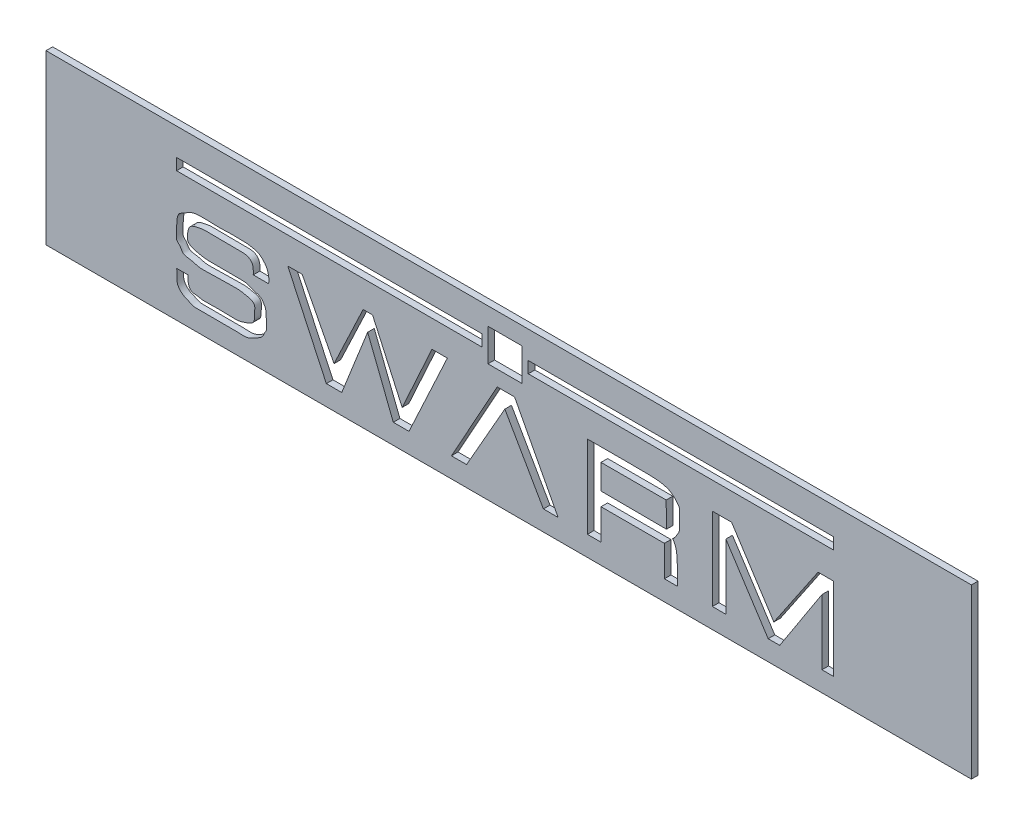
from build123d import *

# Parameters (mm, degrees)
SKETCH1_W           = 444.5
SKETCH1_H           = 80.8
BOSS_EXTRUDE4_DEPTH = 3.175
SKETCH2_W           = 16.441805151
SKETCH2_H           = 15.633348054
SKETCH2_W_2         = 146.679742779
SKETCH2_H_2         = 5.535084634
SKETCH2_W_3         = 146.570115186
CUT_EXTRUDE1_DEPTH  = 16.51


with BuildPart() as part:
    # Sketch1 → Boss-Extrude4 (new body)
    with BuildSketch(Plane.XY):
        Rectangle(SKETCH1_W, SKETCH1_H)
    extrude(amount=-BOSS_EXTRUDE4_DEPTH)

    # Sketch2 → Cut-Extrude1 (cut)
    # profile 1 of 8: a face of its own
    with BuildSketch(Plane.XY):
        Polygon((148.602737407, 8.884542425), (155.961815318, 8.884542425), (155.961815318, -30.781321228), (150.468409481, -30.781321228), (150.468409481, 0.510550481), (130.175928228, -30.781321228), (124.636339422, -30.781321228), (104.301025409, 0.510550481), (104.301025409, -30.781321228), (97.84342667, -30.781321228), (97.84342667, 8.88678531), (107.068567725, 8.88678531), (127.350736795, -22.475093169), align=None)
    # profile 2 of 8: a face of its own
    with BuildSketch(Plane.XY):
        with BuildLine():
            Line((-122.706183837, -3.100392438), (-115.29908876, -3.100392438))
            add(Edge.make_bspline(
                [(-153.955923735, -18.776758223), (-154.285309436, -20.049679681), (-153.998746065, -25.337589484), (-149.679525775, -25.044252719), (-147.12149358, -25.938004263), (-144.206243228, -25.584153299), (-141.137657535, -25.732833066), (-137.67620499, -25.556266991), (-133.579228954, -25.761730355), (-129.745809737, -25.971105624), (-126.603680721, -24.885158192), (-124.452192594, -24.20190402), (-122.333482976, -22.872921562), (-121.993734868, -20.217578477), (-122.074943283, -17.834237964), (-121.832356095, -15.592649885), (-123.350183225, -13.815503909), (-125.913514769, -13.448674393), (-129.84536896, -12.443046304), (-133.982629024, -12.881901543), (-138.256850641, -12.811721774), (-141.637329939, -12.806908226), (-145.040083518, -12.884098216), (-148.83983037, -13.194232926), (-152.353461672, -11.655107864), (-156.686254483, -11.671684433), (-157.610093899, -8.579886425), (-159.707975852, -7.276961097), (-159.507396209, -4.571392822), (-159.635611158, -2.071741332), (-159.338561795, 0.56264845), (-159.249198149, 2.823335191), (-158.445334643, 4.68686483), (-157.174717873, 5.310025192), (-155.62784179, 6.0415247), (-153.481788062, 7.7805497), (-149.806843205, 8.700840026), (-146.185738392, 8.682663541), (-142.925843245, 8.504844854), (-139.440314938, 8.421166009), (-135.909624754, 8.371534854), (-132.135649038, 8.711452422), (-128.754360131, 8.583571975), (-125.049674762, 8.483876189), (-121.973185918, 7.885366456), (-119.550938225, 6.928900557), (-118.392490992, 5.813751928), (-115.720511104, 3.220589753), (-114.860670335, -0.353122863), (-115.29908876, -3.100392438)],
                knots=[0, 0, 0, 0, 0.04400038, 0.060874094, 0.07938466, 0.099252042, 0.11924267, 0.142092473, 0.169517765, 0.203050698, 0.218676173, 0.236483832, 0.249692023, 0.266333318, 0.286427524, 0.300449309, 0.30919807, 0.330906295, 0.350445275, 0.392282993, 0.413701241, 0.437671923, 0.460875468, 0.483403744, 0.513308057, 0.540182664, 0.558429201, 0.571897175, 0.586029079, 0.608413871, 0.624676927, 0.639265682, 0.655062081, 0.662121602, 0.66746828, 0.689978255, 0.717350654, 0.742328991, 0.763637513, 0.783748967, 0.813268626, 0.835402192, 0.860710681, 0.882040584, 0.910691104, 0.924247372, 0.934075314, 0.943084244, 1, 1, 1, 1], degree=3))
            Line((-153.955923735, -18.776758223), (-159.538008772, -18.776758223))
            add(Edge.make_bspline(
                [(-159.538008772, -18.776758223), (-158.925362283, -20.760361158), (-160.033758315, -24.006694583), (-158.075248959, -26.872058664), (-156.78270024, -28.028491892), (-155.354236176, -28.960833271), (-153.611161984, -29.450369401), (-151.686985999, -30.753103815), (-149.028152714, -30.565649032), (-146.248808885, -30.638756877), (-143.496076141, -30.584631862), (-140.357477044, -30.680210232), (-137.063454006, -30.577363223), (-133.573240185, -30.755174777), (-129.764528082, -30.52303754), (-126.026280156, -31.103572059), (-123.095441234, -29.656654233), (-121.048189546, -28.606935839), (-119.512889297, -27.547649878), (-117.980626498, -26.4962726), (-117.594542628, -24.771074437), (-116.217828907, -23.236914704), (-116.272940537, -21.051198463), (-116.42729592, -18.915777646), (-116.514536228, -16.727869933), (-116.533459317, -14.36294187), (-117.62648699, -12.548657427), (-118.741266031, -10.751996487), (-120.884058819, -9.889329264), (-123.321257863, -8.988984103), (-126.128531024, -8.02836013), (-129.179683779, -7.981807119), (-132.656745622, -7.943704335), (-136.166192111, -7.964053265), (-139.691413144, -7.84810928), (-142.703792646, -7.977007334), (-145.746190707, -7.897717976), (-149.019998687, -7.340389276), (-151.799769708, -6.62054001), (-154.373913249, -5.151336486), (-154.416863232, -2.142211913), (-153.984150504, 0.017657557), (-153.322859476, 1.492859471), (-152.184132756, 2.619352296), (-149.724020386, 3.215144509), (-147.051480622, 3.809577893), (-144.514864087, 3.82931155), (-142.088192586, 3.797983337), (-139.404768255, 3.629273426), (-136.019180678, 3.720377938), (-132.422270086, 4.024963793), (-129.00036917, 3.794388889), (-126.034500017, 3.617914677), (-122.479212165, 1.938915926), (-122.627918484, -1.508680575), (-122.706183837, -3.100392438)],
                knots=[0, 0, 0, 0, 0.045054109, 0.05758835, 0.069280287, 0.080801949, 0.092276664, 0.106354194, 0.127201801, 0.14464517, 0.164212612, 0.183717281, 0.209335367, 0.232061115, 0.25549184, 0.288321713, 0.306621771, 0.321382972, 0.335715623, 0.345440891, 0.358195479, 0.370150457, 0.386319627, 0.400449429, 0.414879099, 0.431505659, 0.447942382, 0.457662536, 0.474286106, 0.493165174, 0.51208633, 0.534671909, 0.5554631, 0.583848903, 0.606894263, 0.628074276, 0.645915338, 0.669488199, 0.696094405, 0.705592079, 0.72755691, 0.749036692, 0.752567458, 0.760626615, 0.780862141, 0.803041814, 0.817273886, 0.832852643, 0.853078395, 0.872585188, 0.902545995, 0.927349485, 0.942853212, 0.964340064, 1, 1, 1, 1], degree=3))
        make_face()
    # profile 3 of 8: a face of its own
    with BuildSketch(Plane.XY):
        Polygon((-106.119346245, 8.88678531), (-99.185241155, 8.88678531), (-83.891852119, -20.633666067), (-69.922780319, 8.88678531), (-65.407418328, 8.88678531), (-51.16599244, -22.475093169), (-36.843632737, 8.88678531), (-29.463519893, 8.88678531), (-47.887259549, -30.781321228), (-55.42120072, -30.781321228), (-67.753830536, 0.510550481), (-80.201795697, -30.781321228), (-87.596408079, -30.781321228), align=None)
    # profile 4 of 8: a face of its own
    with BuildSketch(Plane.XY):
        Polygon((-5.505366148, 8.88678531), (2.824473801, 8.88678531), (23.729695985, -30.781321228), (16.655920938, -30.781321228), (-1.848176327, 1.506672466), (-20.238378837, -30.781321228), (-27.519082416, -30.781321228), align=None)
    # profile 5 of 8: a face of its own
    with BuildSketch(Plane.XY):
        with BuildLine():
            Line((81.17749839, -30.781321228), (74.780574032, -30.781321228))
            Line((74.780574032, -30.781321228), (74.780574032, -16.021095539))
            Line((74.780574032, -16.021095539), (44.337608549, -16.021095539))
            Line((44.337608549, -16.021095539), (44.337608549, -30.781321228))
            Line((44.337608549, -30.781321228), (37.80183097, -30.781321228))
            Line((37.80183097, -30.781321228), (37.80183097, 8.88678531))
            add(Edge.make_bspline(
                [(37.80183097, 8.88678531), (46.202035825, 8.777226656), (56.355784417, 8.998243339), (68.942631827, 8.808516299), (74.164768443, 8.500412071), (77.776184262, 7.009425799), (79.105632018, 5.756925746), (80.146929463, 5.076133511), (80.807121703, 3.855937878), (81.978929196, 2.863705539), (82.239898345, 0.569358055), (82.039604769, -1.95901617), (82.12329688, -4.986388546), (82.112129331, -7.619245292), (80.464741012, -9.914446482), (79.799160297, -11.497135692), (78.73254854, -12.124324577)],
                knots=[0, 0, 0, 0, 0.407287174, 0.490760772, 0.610390095, 0.658709793, 0.674574922, 0.698788665, 0.717498056, 0.740770823, 0.770153704, 0.822864477, 0.865361039, 0.917919065, 0.943853308, 1, 1, 1, 1], degree=3))
            add(Edge.make_bspline(
                [(78.73254854, -12.124324577), (80.217532761, -13.964458849), (80.863864781, -17.023736303), (80.928042006, -21.271674642), (81.211256028, -25.35678423), (81.148885002, -28.67382435), (81.17749839, -30.781321228)],
                knots=[0, 0, 0, 0, 0.356855976, 0.478923103, 0.668595171, 1, 1, 1, 1], degree=3))
        make_face()
        Polygon((44.337608549, 2.429186571), (75.639433626, 2.429186571), (75.784268677, -9.671963174), (44.337608549, -9.502988948), align=None, mode=Mode.SUBTRACT)
    # profile 6 of 8: a face of its own
    with BuildSketch(Plane.XY):
        with Locations((-1.748224099, 24.083572181)):
            Rectangle(SKETCH2_W, SKETCH2_H)
    # profile 7 of 8: a face of its own
    with BuildSketch(Plane.XY):
        with Locations((-86.198137383, 24.569525104)):
            Rectangle(SKETCH2_W_2, SKETCH2_H_2)
    # profile 8 of 8: a face of its own
    with BuildSketch(Plane.XY):
        with Locations((82.676757725, 24.569525104)):
            Rectangle(SKETCH2_W_3, SKETCH2_H_2)
    extrude(amount=-CUT_EXTRUDE1_DEPTH, mode=Mode.SUBTRACT)


with BuildPart() as cut_extrude1_piece_1:
    # of the separate pieces the step leaves, piece 1, a body of its own (cut_extrude1_pieces)
    add(part.part.solids().sort_by_distance((-222.25, -40.4, 0))[0])


with BuildPart() as cut_extrude1_piece_2:
    # of the separate pieces the step leaves, piece 2, a body of its own (cut_extrude1_pieces)
    add(part.part.solids().sort_by_distance((44.337608549, -9.502988948, 0))[0])


solid = Compound([cut_extrude1_piece_1.part, cut_extrude1_piece_2.part])
